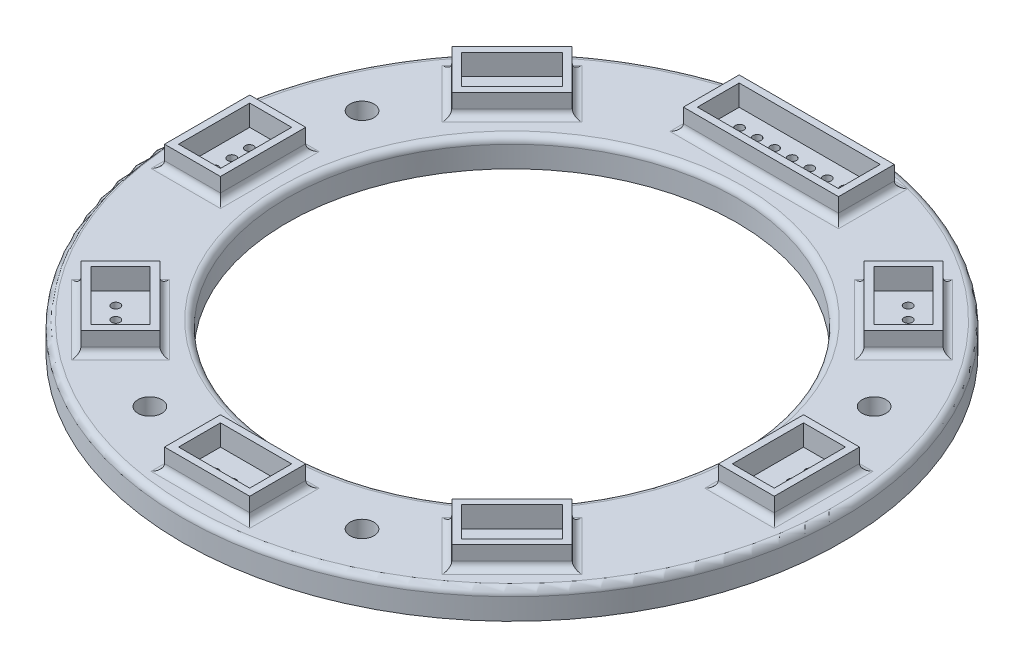
from build123d import *

# Parameters (mm, degrees)
SKETCH1_R            = 47
SKETCH1_R_2          = 32.05
BOSS_EXTRUDE1_DEPTH  = 1
BOSS_EXTRUDE2_START  = 3
SKETCH2_R            = 47
SKETCH2_R_2          = 46
SKETCH2_R_3          = 33.05
SKETCH2_R_4          = 32.05
BOSS_EXTRUDE2_DEPTH  = 3
BOSS_EXTRUDE3_DEPTH  = 3
CUT_EXTRUDE2_REACH   = 68.588
SKETCH7_R            = 0.6
CIRPATTERN4_COUNT    = 8
SKETCH5_W            = 22.12
SKETCH5_H            = 7.96
SKETCH5_W_2          = 20.12
SKETCH5_H_2          = 5.96
BOSS_EXTRUDE4_DEPTH  = 3
FILLET2_R            = 0.96
CIRPATTERN5_COUNT    = 8
SKETCH9_R            = 3
BOSS_EXTRUDE5_DEPTH  = 3
M3_CLEARANCE_HOLE1_D = 3.4
FILLET3_R            = 1.5
FILLET3_OF_MIRROR1_R = 1.5
CUT_EXTRUDE3_REACH   = 68.588
SKETCH12_R           = 0.6


with BuildPart() as part:
    # Sketch1 → Boss-Extrude1 (new body)
    with BuildSketch(Plane(origin=(0, 0, 0), x_dir=(1, 0, 0), z_dir=(0, 1, 0))):
        with Locations(Location((0, 0, 0), (0, 0, 270))):
            Circle(SKETCH1_R)
        with Locations(Location((0, 0, 0), (0, 0, 270))):
            Circle(SKETCH1_R_2, mode=Mode.SUBTRACT)
    extrude(amount=BOSS_EXTRUDE1_DEPTH)

    # Sketch2 → Boss-Extrude2 (add)
    # profile 1 of 2: a face of its own
    with BuildSketch(Plane.XZ.offset(BOSS_EXTRUDE2_START)):
        with Locations(Location((0, 0, 0), (0, 0, 270))):
            Circle(SKETCH2_R)
        with Locations(Location((0, 0, 0), (0, 0, 270))):
            Circle(SKETCH2_R_2, mode=Mode.SUBTRACT)
    # profile 2 of 2: a face of its own
    with BuildSketch(Plane.XZ.offset(BOSS_EXTRUDE2_START)):
        with Locations(Location((0, 0, 0), (0, 0, 90))):
            Circle(SKETCH2_R_3)
        with Locations(Location((0, 0, 0), (0, 0, 270))):
            Circle(SKETCH2_R_4, mode=Mode.SUBTRACT)
    extrude(amount=-BOSS_EXTRUDE2_DEPTH)

    # Sketch4 → Boss-Extrude3 (add)
    with BuildSketch(Plane(origin=(0, 1, 0), x_dir=(1, 0, 0), z_dir=(0, 1, 0))):
        Polygon((29.397964428, 20.806617036), (35.040676542, 26.44932915), (26.44932915, 35.040676542), (20.806617036, 29.397964428), align=None)
        Polygon((29.397964428, 22.220830599), (33.626462979, 26.44932915), (26.44932915, 33.626462979), (22.220830599, 29.397964428), align=None, mode=Mode.SUBTRACT)
    boss_extrude3 = extrude(amount=BOSS_EXTRUDE3_DEPTH)

    # Sketch7 → Cut-Extrude2 (cut, up to next)
    with BuildSketch(Plane(origin=(0, 1, 0), x_dir=(1, 0, 0), z_dir=(0, 1, 0)), mode=Mode.PRIVATE) as cut_extrude2_sk1:
        with Locations(Location((-30.018662817, 26.483128798, 0), (0, 0, 270))):
            Circle(SKETCH7_R)
    cut_extrude2_tool1 = extrude(cut_extrude2_sk1.sketch, amount=-CUT_EXTRUDE2_REACH, mode=Mode.PRIVATE) & part.part
    # Sketch7 → Cut-Extrude2 (cut, up to next)
    with BuildSketch(Plane(origin=(0, 1, 0), x_dir=(1, 0, 0), z_dir=(0, 1, 0)), mode=Mode.PRIVATE) as cut_extrude2_sk2:
        with Locations(Location((-28.250895807, 28.250895807, 0), (0, 0, 270))):
            Circle(SKETCH7_R)
    cut_extrude2_tool2 = extrude(cut_extrude2_sk2.sketch, amount=-CUT_EXTRUDE2_REACH, mode=Mode.PRIVATE) & part.part
    # Sketch7 → Cut-Extrude2 (cut, up to next)
    with BuildSketch(Plane(origin=(0, 1, 0), x_dir=(1, 0, 0), z_dir=(0, 1, 0)), mode=Mode.PRIVATE) as cut_extrude2_sk3:
        with Locations(Location((-26.483128798, 30.018662817, 0), (0, 0, 270))):
            Circle(SKETCH7_R)
    cut_extrude2_tool3 = extrude(cut_extrude2_sk3.sketch, amount=-CUT_EXTRUDE2_REACH, mode=Mode.PRIVATE) & part.part
    cut_extrude2_1 = cut_extrude2_tool1.solids().sort_by_distance((-30.018663, 1, -26.483129))[0]
    add(cut_extrude2_1, mode=Mode.SUBTRACT)
    cut_extrude2_2 = cut_extrude2_tool2.solids().sort_by_distance((-28.250896, 1, -28.250896))[0]
    add(cut_extrude2_2, mode=Mode.SUBTRACT)
    cut_extrude2_3 = cut_extrude2_tool3.solids().sort_by_distance((-26.483129, 1, -30.018663))[0]
    add(cut_extrude2_3, mode=Mode.SUBTRACT)
    cut_extrude2 = cut_extrude2_1 + cut_extrude2_2 + cut_extrude2_3  # Cut-Extrude2 as one shape, for the pattern or mirror that repeats it

    # CirPattern4: Boss-Extrude3 ×8 about axis, 1 skipped
    cirpattern4_axis = Axis((0, 0, 0), (0, -1, 0))
    add([boss_extrude3.rotate(cirpattern4_axis, i * 360 / CIRPATTERN4_COUNT) for i in range(1, CIRPATTERN4_COUNT) if i not in (7,)])

    # Sketch5 → Boss-Extrude4 (add)
    with BuildSketch(Plane(origin=(0, 1, 0), x_dir=(1, 0, 0), z_dir=(0, 1, 0))):
        with Locations((0, 39.48)):
            Rectangle(SKETCH5_W, SKETCH5_H)
        with Locations((0, 39.48)):
            Rectangle(SKETCH5_W_2, SKETCH5_H_2, mode=Mode.SUBTRACT)
    extrude(amount=BOSS_EXTRUDE4_DEPTH)

    # Fillet2
    fillet2_edges = [part.edges().sort_by_distance(p)[0] for p in [
        (-6.075, 1, 39.49),
        (0, 1, 43.48),
        (6.075, 1, 39.49),
        (0, 1, 35.5),
        (-32.219320485, 1, 23.627973093),
        (-30.745002846, 1, 30.745002846),
        (-23.627973093, 1, 32.219320485),
        (-25.102290732, 1, 25.102290732),
        (-39.49, 1, -6.075),
        (-43.48, 1, 0),
        (-39.49, 1, 6.075),
        (-35.5, 1, 0),
        (-23.627973093, 1, -32.219320485),
        (-30.745002846, 1, -30.745002846),
        (-32.219320485, 1, -23.627973093),
        (-25.102290732, 1, -25.102290732),
        (0, 1, -35.5),
        (11.06, 1, -39.48),
        (-11.06, 1, -39.48),
        (0, 1, -43.46),
        (32.219320485, 1, -23.627973093),
        (30.745002846, 1, -30.745002846),
        (23.627973093, 1, -32.219320485),
        (25.102290732, 1, -25.102290732),
        (0, 1, -47),
        (0, 1, -32.05),
        (39.49, 1, 6.075),
        (43.48, 1, 0),
        (39.49, 1, -6.075),
        (35.5, 1, 0),
        (23.627973093, 1, 32.219320485),
        (30.745002846, 1, 30.745002846),
        (32.219320485, 1, 23.627973093),
        (25.102290732, 1, 25.102290732),
    ]]
    fillet(fillet2_edges, radius=FILLET2_R)

    # CirPattern5: Cut-Extrude2 ×8 about axis, 1 skipped
    cirpattern5_axis = Axis((0, -3, 0), (0, -1, 0))
    add([cut_extrude2.rotate(cirpattern5_axis, i * 360 / CIRPATTERN5_COUNT) for i in range(1, CIRPATTERN5_COUNT) if i not in (1,)], mode=Mode.SUBTRACT)

    # Sketch9 → Boss-Extrude5 (add)
    with BuildSketch(Plane.XZ):
        with Locations(Location((-36.516338523, -15.125562664, 0), (0, 0, 90))):
            Circle(SKETCH9_R)
        with Locations(Location((-15.125562664, 36.516338523, 0), (0, 0, 90))):
            Circle(SKETCH9_R)
    boss_extrude5 = extrude(amount=BOSS_EXTRUDE5_DEPTH)

    # M3 Clearance Hole1 (through all)
    with Locations(Plane(origin=(0, 1, 0), x_dir=(1, 0, 0), z_dir=(0, 1, 0))):
        with Locations((-15.125562664, -36.516338523), (-36.516338523, 15.125562664)):
            m3_clearance_hole1 = Hole(M3_CLEARANCE_HOLE1_D / 2)

    # Fillet3
    fillet3_edges = [part.edges().sort_by_distance(p)[0] for p in [
        (-36.516338523, 0, -18.125562664),
        (-15.125562664, 0, 33.516338523),
    ]]
    fillet(fillet3_edges, radius=FILLET3_R)

    # Mirror1: Boss-Extrude5, M3 Clearance Hole1 across plane
    add(boss_extrude5.mirror(Plane(origin=(0, 0, 0), x_dir=(0, 0, 1), z_dir=(1, 0, 0))))
    add(m3_clearance_hole1.mirror(Plane(origin=(0, 0, 0), x_dir=(0, 0, 1), z_dir=(1, 0, 0))), mode=Mode.SUBTRACT)

    # Fillet3 of Mirror1
    fillet3_of_mirror1_edges = [part.edges().sort_by_distance(p)[0] for p in [
        (36.516338523, 0, -18.125562664),
        (15.125562664, 0, 33.516338523),
    ]]
    fillet(fillet3_of_mirror1_edges, radius=FILLET3_OF_MIRROR1_R)

    # Sketch12 → Cut-Extrude3 (cut, up to next)
    with BuildSketch(Plane(origin=(0, 1, 0), x_dir=(1, 0, 0), z_dir=(0, 1, 0)), mode=Mode.PRIVATE) as cut_extrude3_sk1:
        with Locations(Location((-7.50000024, 39.9528, 0), (0, 0, 270))):
            Circle(SKETCH12_R)
    cut_extrude3_tool1 = extrude(cut_extrude3_sk1.sketch, amount=-CUT_EXTRUDE3_REACH, mode=Mode.PRIVATE) & part.part
    # Sketch12 → Cut-Extrude3 (cut, up to next)
    with BuildSketch(Plane(origin=(0, 1, 0), x_dir=(1, 0, 0), z_dir=(0, 1, 0)), mode=Mode.PRIVATE) as cut_extrude3_sk2:
        with Locations(Location((-5.00000016, 39.9528, 0), (0, 0, 270))):
            Circle(SKETCH12_R)
    cut_extrude3_tool2 = extrude(cut_extrude3_sk2.sketch, amount=-CUT_EXTRUDE3_REACH, mode=Mode.PRIVATE) & part.part
    # Sketch12 → Cut-Extrude3 (cut, up to next)
    with BuildSketch(Plane(origin=(0, 1, 0), x_dir=(1, 0, 0), z_dir=(0, 1, 0)), mode=Mode.PRIVATE) as cut_extrude3_sk3:
        with Locations(Location((-2.50000008, 39.9528, 0), (0, 0, 270))):
            Circle(SKETCH12_R)
    cut_extrude3_tool3 = extrude(cut_extrude3_sk3.sketch, amount=-CUT_EXTRUDE3_REACH, mode=Mode.PRIVATE) & part.part
    # Sketch12 → Cut-Extrude3 (cut, up to next)
    with BuildSketch(Plane(origin=(0, 1, 0), x_dir=(1, 0, 0), z_dir=(0, 1, 0)), mode=Mode.PRIVATE) as cut_extrude3_sk4:
        with Locations(Location((0, 39.9528, 0), (0, 0, 270))):
            Circle(SKETCH12_R)
    cut_extrude3_tool4 = extrude(cut_extrude3_sk4.sketch, amount=-CUT_EXTRUDE3_REACH, mode=Mode.PRIVATE) & part.part
    # Sketch12 → Cut-Extrude3 (cut, up to next)
    with BuildSketch(Plane(origin=(0, 1, 0), x_dir=(1, 0, 0), z_dir=(0, 1, 0)), mode=Mode.PRIVATE) as cut_extrude3_sk5:
        with Locations(Location((2.50000008, 39.9528, 0), (0, 0, 270))):
            Circle(SKETCH12_R)
    cut_extrude3_tool5 = extrude(cut_extrude3_sk5.sketch, amount=-CUT_EXTRUDE3_REACH, mode=Mode.PRIVATE) & part.part
    # Sketch12 → Cut-Extrude3 (cut, up to next)
    with BuildSketch(Plane(origin=(0, 1, 0), x_dir=(1, 0, 0), z_dir=(0, 1, 0)), mode=Mode.PRIVATE) as cut_extrude3_sk6:
        with Locations(Location((5.00000016, 39.9528, 0), (0, 0, 270))):
            Circle(SKETCH12_R)
    cut_extrude3_tool6 = extrude(cut_extrude3_sk6.sketch, amount=-CUT_EXTRUDE3_REACH, mode=Mode.PRIVATE) & part.part
    # Sketch12 → Cut-Extrude3 (cut, up to next)
    with BuildSketch(Plane(origin=(0, 1, 0), x_dir=(1, 0, 0), z_dir=(0, 1, 0)), mode=Mode.PRIVATE) as cut_extrude3_sk7:
        with Locations(Location((7.50000024, 39.9528, 0), (0, 0, 270))):
            Circle(SKETCH12_R)
    cut_extrude3_tool7 = extrude(cut_extrude3_sk7.sketch, amount=-CUT_EXTRUDE3_REACH, mode=Mode.PRIVATE) & part.part
    add(cut_extrude3_tool1.solids().sort_by_distance((-7.5, 1, -39.9528))[0], mode=Mode.SUBTRACT)
    add(cut_extrude3_tool2.solids().sort_by_distance((-5, 1, -39.9528))[0], mode=Mode.SUBTRACT)
    add(cut_extrude3_tool3.solids().sort_by_distance((-2.5, 1, -39.9528))[0], mode=Mode.SUBTRACT)
    add(cut_extrude3_tool4.solids().sort_by_distance((0, 1, -39.9528))[0], mode=Mode.SUBTRACT)
    add(cut_extrude3_tool5.solids().sort_by_distance((2.5, 1, -39.9528))[0], mode=Mode.SUBTRACT)
    add(cut_extrude3_tool6.solids().sort_by_distance((5, 1, -39.9528))[0], mode=Mode.SUBTRACT)
    add(cut_extrude3_tool7.solids().sort_by_distance((7.5, 1, -39.9528))[0], mode=Mode.SUBTRACT)


solid = part.part
